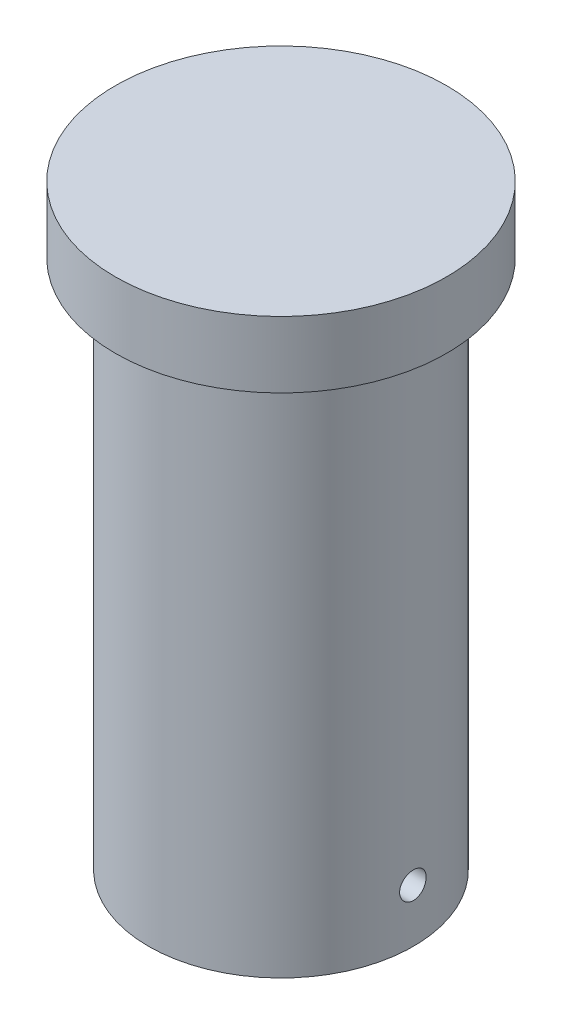
from build123d import *

# Parameters (mm, degrees)
SKETCH1_R               = 5
BOSS_EXTRUDE1_DEPTH     = 20
SKETCH3_R               = 6.25
BOSS_EXTRUDE3_DEPTH     = 2.5
CUT_EXTRUDE1_DEPTH      = 25.173849507
CUT_EXTRUDE1_DEPTH_BACK = 25.173849507
SKETCH4_R               = 0.5


with BuildPart() as part:
    # Sketch1 → Boss-Extrude1 (new body)
    with BuildSketch(Plane(origin=(0, 0, 0), x_dir=(1, 0, 0), z_dir=(0, 1, 0))):
        with Locations(Location((0, 0, 0), (0, 0, 270))):
            Circle(SKETCH1_R)
    extrude(amount=BOSS_EXTRUDE1_DEPTH)

    # Sketch3 → Boss-Extrude3 (add)
    with BuildSketch(Plane(origin=(0, 20, 0), x_dir=(1, 0, 0), z_dir=(0, 1, 0))):
        with Locations(Location((0, 0, 0), (0, 0, 270))):
            Circle(SKETCH3_R)
    extrude(amount=BOSS_EXTRUDE3_DEPTH)

    # Sketch4 → Cut-Extrude1 (cut, two sides: drawn at the far end of the back side and taken through both)
    with BuildSketch(Plane(origin=(0, 0, 0), x_dir=(0, 0, -1), z_dir=(1, 0, 0)).offset(-CUT_EXTRUDE1_DEPTH_BACK)):
        with Locations((0, 2)):
            Circle(SKETCH4_R)
    extrude(amount=CUT_EXTRUDE1_DEPTH + CUT_EXTRUDE1_DEPTH_BACK, mode=Mode.SUBTRACT)


solid = part.part
